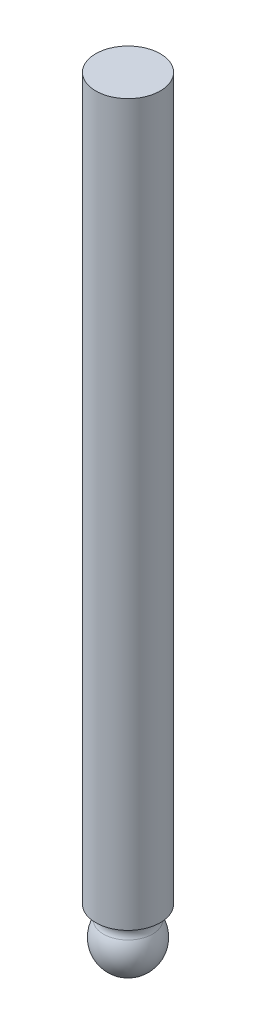
from build123d import *

# Parameters (mm, degrees)
SKETCH1_R           = 3.556
BOSS_EXTRUDE1_DEPTH = 79.375


with BuildPart() as part:
    # Sketch1 → Boss-Extrude1 (new body)
    with BuildSketch(Plane(origin=(0, 0, 0), x_dir=(1, 0, 0), z_dir=(0, 1, 0))):
        with Locations(Location((0, 0, 0), (0, 0, 90))):
            Circle(SKETCH1_R)
    extrude(amount=BOSS_EXTRUDE1_DEPTH)

    # Sketch2 → Revolve1 (revolve)
    with BuildSketch(Plane.XY, mode=Mode.PRIVATE) as revolve1_sk:
        with BuildLine():
            Line((3.556, 0), (0, 0))
            Line((0, 0), (0, -6.35))
            ThreePointArc((0, -6.35), (2.770206601, -4.726315696), (2.707064555, -1.515956151))
            ThreePointArc((2.707064555, -1.515956151), (2.68726321, -0.509187398), (3.556, 0))
        make_face()
    revolve(revolve1_sk.sketch.rotate(Axis((0, 0, 0), (0, -1, 0)), 180), axis=Axis((0, 0, 0), (0, -1, 0)))


solid = part.part
